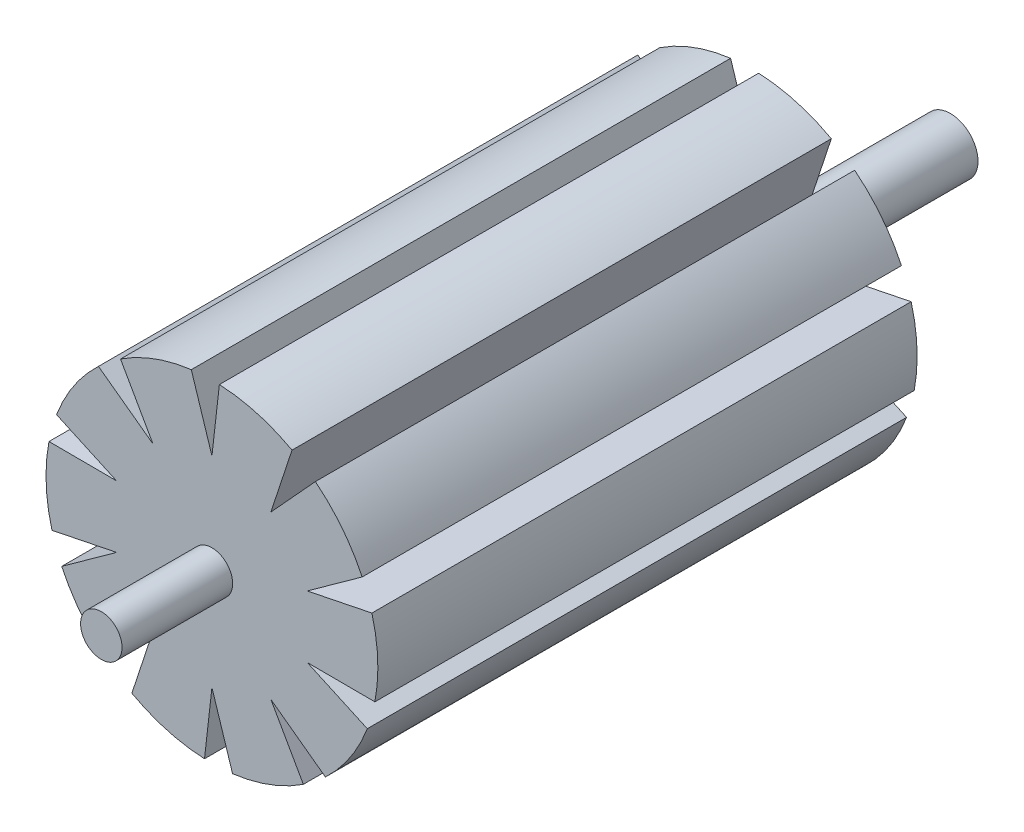
from build123d import *

# Parameters (mm, degrees)
SKETCH1_R           = 6
BOSS_EXTRUDE1_DEPTH = 19.5
SKETCH1_3_R         = 1
BOSS_EXTRUDE2_DEPTH = 7.2
CUT_EXTRUDE4_DEPTH  = 55
SKETCH2_R           = 0.75
BOSS_EXTRUDE3_DEPTH = 4


with BuildPart() as part:
    # Sketch1 → Boss-Extrude1 (new body)
    with BuildSketch(Plane.XY):
        Circle(SKETCH1_R)
    extrude(amount=BOSS_EXTRUDE1_DEPTH)

    # Sketch1<3> → Boss-Extrude2 (add)
    with BuildSketch(Plane.XY):
        Circle(SKETCH1_3_R)
    extrude(amount=-BOSS_EXTRUDE2_DEPTH)

    # Sketch1<6> → Cut-Extrude4 (cut)
    with BuildSketch(Plane.XY):
        Polygon((0, 3.624712615), (0.894290994, 11.509067598), (-2.470474832, 11.33660338), align=None)
        Polygon((4.664832155, 10.623613465), (7.488356813, 8.785380219), (2.130552619, 2.932454105), align=None)
        Polygon((10.01833181, 5.85276429), (11.222124851, 2.7059762), (3.447306552, 1.120097798), align=None)
        Polygon((11.545169224, -1.153641916), (10.669422621, -4.407018754), (3.447306552, -1.120097798), align=None)
        Polygon((8.662144401, -7.71939612), (6.04136359, -9.836682333), (2.130552619, -2.932454105), align=None)
        Polygon((2.470474832, -11.33660338), (-0.894290994, -11.509067598), (0, -3.624712615), align=None)
        Polygon((-4.664832155, -10.623613465), (-7.488356813, -8.785380219), (-2.130552619, -2.932454105), align=None)
        Polygon((-10.01833181, -5.85276429), (-11.222124851, -2.7059762), (-3.447306552, -1.120097798), align=None)
        Polygon((-11.545169224, 1.153641916), (-10.669422621, 4.407018754), (-3.447306552, 1.120097798), align=None)
        Polygon((-8.662144401, 7.71939612), (-6.04136359, 9.836682333), (-2.130552619, 2.932454105), align=None)
    extrude(amount=CUT_EXTRUDE4_DEPTH, mode=Mode.SUBTRACT)

    # Sketch2 → Boss-Extrude3 (add)
    with BuildSketch(Plane.XY.offset(19.5)):
        Circle(SKETCH2_R)
    extrude(amount=BOSS_EXTRUDE3_DEPTH)


solid = part.part
